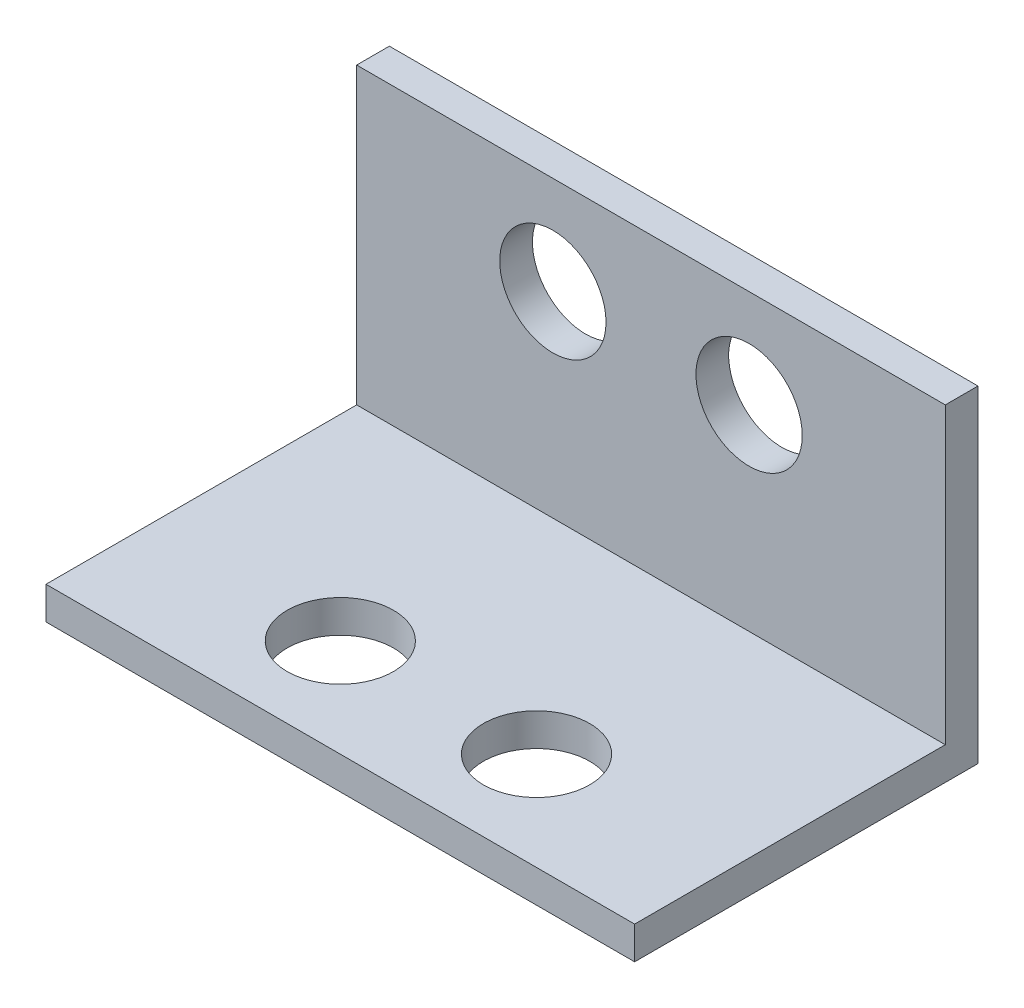
from build123d import *

# Parameters (mm, degrees)
SKETCH1_W           = 18
SKETCH1_H           = 10.5
SKETCH1_R           = 1.625
BOSS_EXTRUDE1_DEPTH = 1
SKETCH2_W           = 18
SKETCH2_H           = 1
BOSS_EXTRUDE2_DEPTH = 9
SKETCH4_R           = 1.625
CUT_EXTRUDE1_DEPTH  = 23.677080941


with BuildPart() as part:
    # Sketch1 → Boss-Extrude1 (new body)
    with BuildSketch(Plane(origin=(0, 0, 0), x_dir=(1, 0, 0), z_dir=(0, 1, 0))):
        with Locations((9, 5.25)):
            Rectangle(SKETCH1_W, SKETCH1_H)
        with Locations(Location((6, 3, 0), (0, 0, 270))):
            Circle(SKETCH1_R, mode=Mode.SUBTRACT)
        with Locations(Location((12, 3, 0), (0, 0, 270))):
            Circle(SKETCH1_R, mode=Mode.SUBTRACT)
    extrude(amount=BOSS_EXTRUDE1_DEPTH)

    # Sketch2 → Boss-Extrude2 (add)
    with BuildSketch(Plane(origin=(0, 1, 0), x_dir=(1, 0, 0), z_dir=(0, 1, 0))):
        with Locations((9, 10)):
            Rectangle(SKETCH2_W, SKETCH2_H)
    extrude(amount=BOSS_EXTRUDE2_DEPTH)

    # Sketch4 → Cut-Extrude1 (cut, through all)
    with BuildSketch(Plane.XY.offset(-9.5)):
        with Locations((6, 7)):
            Circle(SKETCH4_R)
        with Locations((12, 7)):
            Circle(SKETCH4_R)
    extrude(amount=-CUT_EXTRUDE1_DEPTH, mode=Mode.SUBTRACT)


solid = part.part
